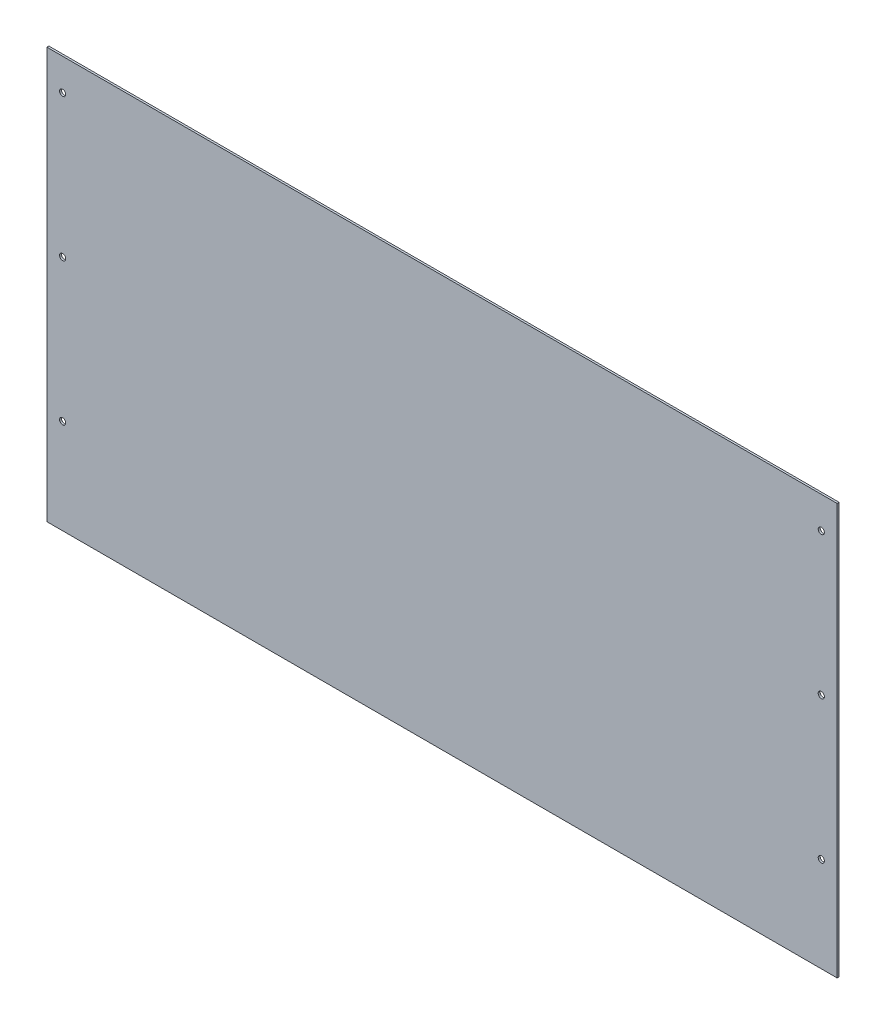
from build123d import *

# Parameters (mm, degrees)
SKETCH3_W              = 635
SKETCH3_H              = 330.2
BOSS_EXTRUDE1_DEPTH    = 0.79375
F_10_CLEARANCE_HOLE1_D = 4.9784


with BuildPart() as part:
    # Sketch3 → Boss-Extrude1 (new, symmetric)
    with BuildSketch(Plane.XY):
        Rectangle(SKETCH3_W, SKETCH3_H)
    extrude(amount=BOSS_EXTRUDE1_DEPTH, both=True)

    # #10 Clearance Hole1 (through all)
    with Locations(Plane.XY.offset(0.79375)):
        with Locations((-304.8, 139.7), (-304.8, 25.4), (-304.8, -88.9), (304.735940926, 139.7), (304.735940926, 25.4), (304.735940926, -88.9)):
            Hole(F_10_CLEARANCE_HOLE1_D / 2)


solid = part.part
